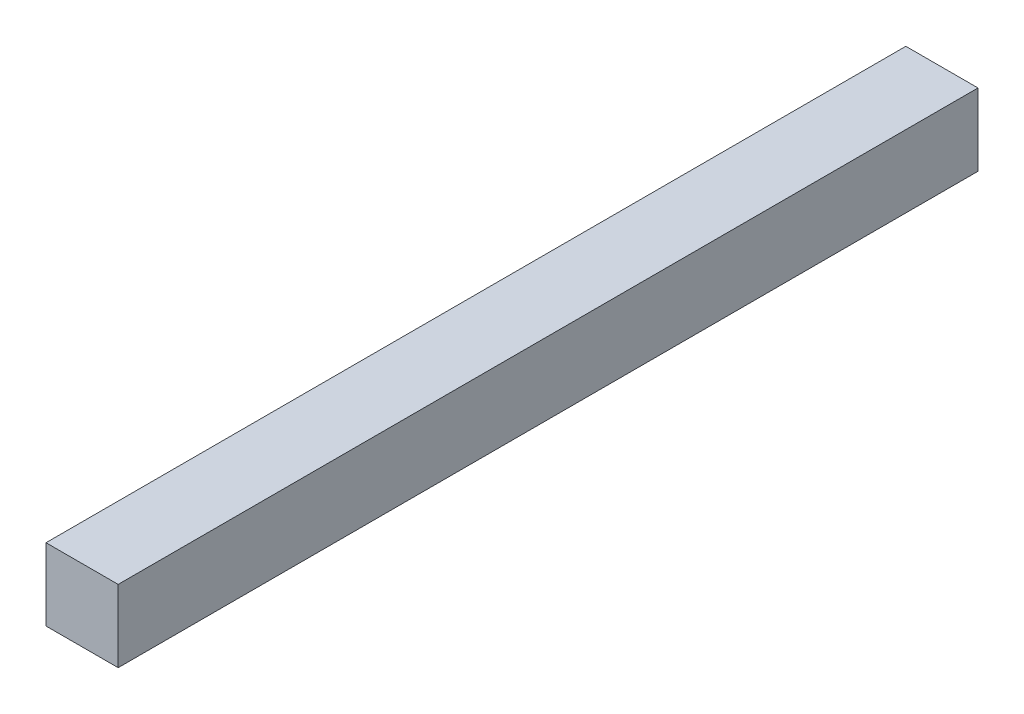
from build123d import *

# Parameters (mm, degrees)
SKETCH1_W           = 4.7
SKETCH1_H           = 4.7
BOSS_EXTRUDE1_DEPTH = 56


with BuildPart() as part:
    # Sketch1 → Boss-Extrude1 (new body)
    with BuildSketch(Plane.XY):
        Rectangle(SKETCH1_W, SKETCH1_H)
    extrude(amount=BOSS_EXTRUDE1_DEPTH)


solid = part.part
